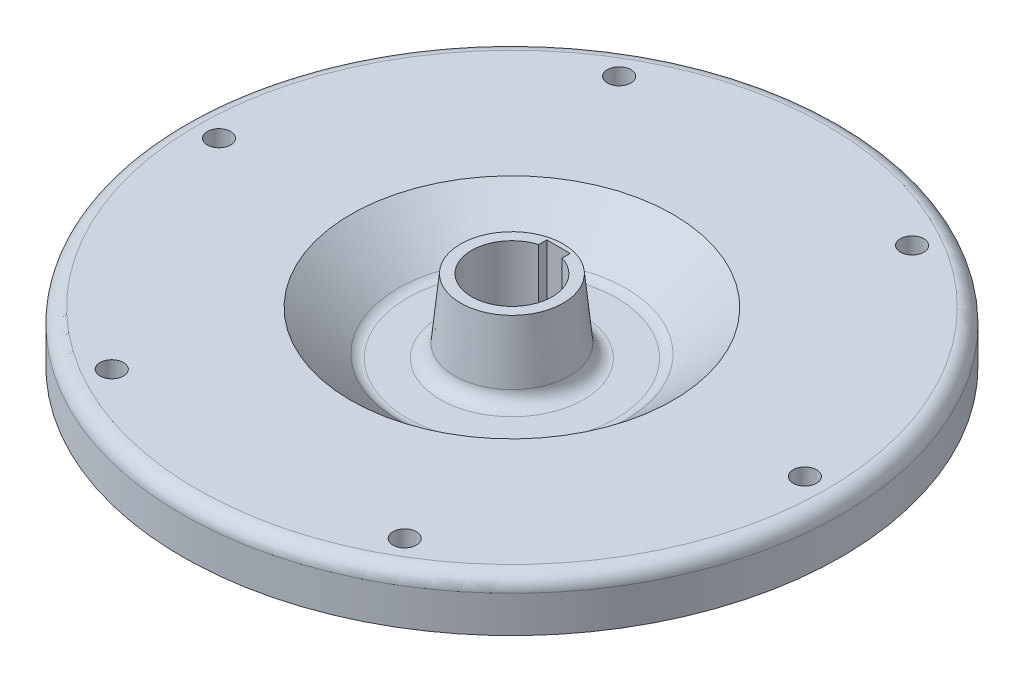
from build123d import *

# Parameters (mm, degrees)
CUT_EXTRUDE1_DEPTH      = 348.634865915
CUT_EXTRUDE1_DEPTH_BACK = 348.634865915
SKETCH2_R               = 8
CUT_EXTRUDE2_DEPTH      = 357.16007637
CUT_EXTRUDE2_DEPTH_BACK = 357.16007637


with BuildPart() as part:
    # Sketch1 → Revolve1 (revolve)
    with BuildSketch(Plane.XY, mode=Mode.PRIVATE) as revolve1_sk:
        with BuildLine():
            Line((27.5, 0), (65, 0))
            ThreePointArc((65, 0), (72.071067812, 2.928932188), (75, 10))
            Line((75, 10), (75, 35))
            ThreePointArc((75, 35), (85.251262658, 59.748737342), (110, 70))
            Line((110, 70), (175, 70))
            Line((175, 70), (175, 105))
            Line((175, 105), (225, 105))
            Line((225, 105), (225, 130))
            ThreePointArc((225, 130), (222.071067812, 137.071067812), (215, 140))
            Line((215, 140), (110, 140))
            Line((110, 140), (77.808672972, 112.407433976))
            ThreePointArc((77.808672972, 112.407433976), (74.770221715, 110.621149851), (71.300759238, 110))
            Line((71.300759238, 110), (49.049875621, 110))
            ThreePointArc((49.049875621, 110), (42.339822414, 112.585474664), (39.099503719, 119.00496281))
            Line((39.099503719, 119.00496281), (35, 160))
            Line((35, 160), (27.5, 160))
            Line((27.5, 160), (27.5, 0))
        make_face()
    revolve(revolve1_sk.sketch.rotate(Axis((0, 0, 0), (0, 1, 0)), 90), axis=Axis((0, 0, 0), (0, 1, 0)))

    # Sketch2 → Cut-Extrude1 (cut, two sides: drawn at the far end of the back side and taken through both)
    with BuildSketch(Plane(origin=(0, 140, 0), x_dir=(1, 0, 0), z_dir=(0, 1, 0)).offset(-CUT_EXTRUDE1_DEPTH_BACK)):
        with Locations(Location((200, 0, 0), (0, 0, 270))):
            Circle(SKETCH2_R)
        with Locations(Location((100, -173.205080757, 0), (0, 0, 270))):
            Circle(SKETCH2_R)
        with Locations(Location((-100, -173.205080757, 0), (0, 0, 270))):
            Circle(SKETCH2_R)
        with Locations(Location((-200, 0, 0), (0, 0, 270))):
            Circle(SKETCH2_R)
        with Locations(Location((-100, 173.205080757, 0), (0, 0, 270))):
            Circle(SKETCH2_R)
        with Locations(Location((100, 173.205080757, 0), (0, 0, 270))):
            Circle(SKETCH2_R)
    extrude(amount=CUT_EXTRUDE1_DEPTH + CUT_EXTRUDE1_DEPTH_BACK, mode=Mode.SUBTRACT)

    # Sketch3 → Cut-Extrude2 (cut, two sides: drawn at the far end of the back side and taken through both)
    with BuildSketch(Plane(origin=(0, 160, 0), x_dir=(1, 0, 0), z_dir=(0, 1, 0)).offset(-CUT_EXTRUDE2_DEPTH_BACK)):
        with BuildLine():
            Line((-8, 26.310644234), (-8, 31.8))
            Line((-8, 31.8), (8, 31.8))
            Line((8, 31.8), (8, 26.310644234))
            ThreePointArc((8, 26.310644234), (0, 27.5), (-8, 26.310644234))
        make_face()
    extrude(amount=CUT_EXTRUDE2_DEPTH + CUT_EXTRUDE2_DEPTH_BACK, mode=Mode.SUBTRACT)


solid = part.part
